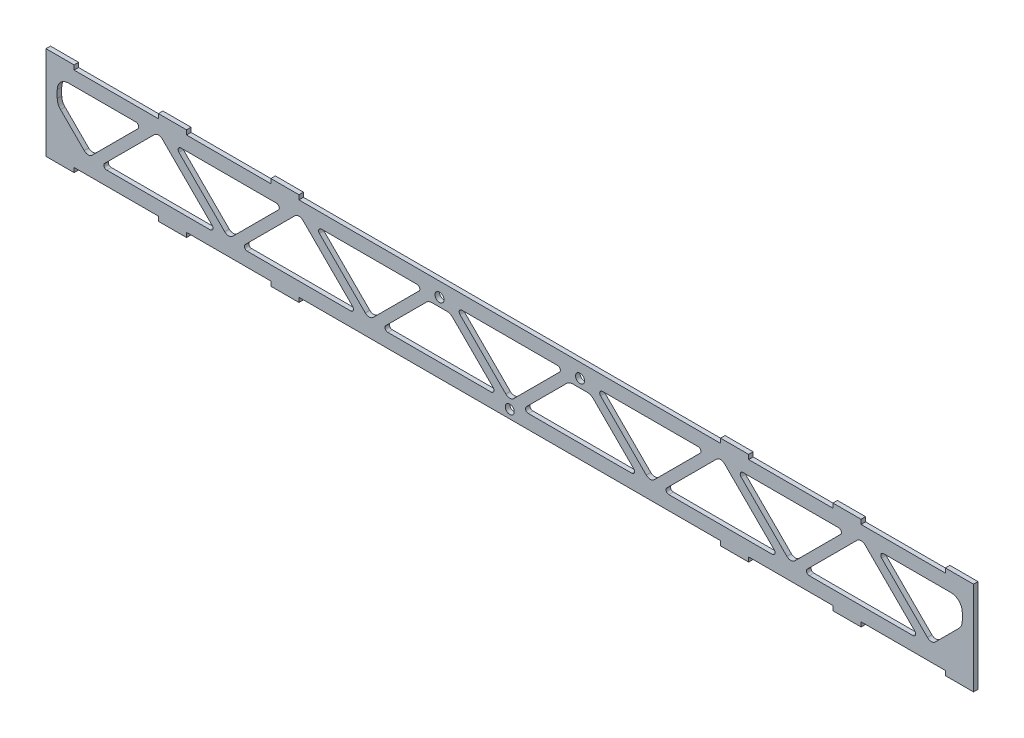
from build123d import *

# Parameters (mm, degrees)
SKETCH1_W           = 360
SKETCH1_H           = 30
BOSS_EXTRUDE1_DEPTH = 1.6
SKETCH2_W           = 10
SKETCH2_H           = 1.6
BOSS_EXTRUDE2_DEPTH = 1.6
CUT_EXTRUDE1_DEPTH  = 181.770904739
CUT_EXTRUDE2_DEPTH  = 181.770904739
SKETCH5_W           = 15
SKETCH5_H           = 30
CUT_EXTRUDE3_DEPTH  = 181.770904739
SKETCH6_W           = 4
SKETCH6_H           = 33.2
BOSS_EXTRUDE3_DEPTH = 1.6
FILLET1_R           = 4
BOSS_EXTRUDE4_DEPTH = 1.6
SKETCH8_R           = 1.6
CUT_EXTRUDE4_DEPTH  = 166.840646405


with BuildPart() as part:
    # Sketch1 → Boss-Extrude1 (new body)
    with BuildSketch(Plane.XY):
        Rectangle(SKETCH1_W, SKETCH1_H)
    extrude(amount=BOSS_EXTRUDE1_DEPTH)

    # Sketch2 → Boss-Extrude2 (add)
    with BuildSketch(Plane.XY.offset(1.6)):
        with Locations((120, 15.8)):
            Rectangle(SKETCH2_W, SKETCH2_H)
        with Locations((80, 15.8)):
            Rectangle(SKETCH2_W, SKETCH2_H)
        with Locations((160, 15.8)):
            Rectangle(SKETCH2_W, SKETCH2_H)
        with Locations((-160, 15.8)):
            Rectangle(SKETCH2_W, SKETCH2_H)
        with Locations((-120, 15.8)):
            Rectangle(SKETCH2_W, SKETCH2_H)
        with Locations((-80, 15.8)):
            Rectangle(SKETCH2_W, SKETCH2_H)
        with Locations((-120, -15.8)):
            Rectangle(SKETCH2_W, SKETCH2_H)
        with Locations((-80, -15.8)):
            Rectangle(SKETCH2_W, SKETCH2_H)
        with Locations((-160, -15.8)):
            Rectangle(SKETCH2_W, SKETCH2_H)
        with Locations((160, -15.8)):
            Rectangle(SKETCH2_W, SKETCH2_H)
        with Locations((120, -15.8)):
            Rectangle(SKETCH2_W, SKETCH2_H)
        with Locations((80, -15.8)):
            Rectangle(SKETCH2_W, SKETCH2_H)
    extrude(amount=-BOSS_EXTRUDE2_DEPTH)

    # Sketch3 → Cut-Extrude1 (cut, through all)
    with BuildSketch(Plane.XY.offset(1.6)):
        with BuildLine():
            Line((-167, 10), (-133, 10))
            ThreePointArc((-133, 10), (-132.076120467, 9.382683432), (-132.292893219, 8.292893219))
            Line((-132.292893219, 8.292893219), (-148.585786438, -8))
            ThreePointArc((-148.585786438, -8), (-150, -8.585786438), (-151.414213562, -8))
            Line((-151.414213562, -8), (-167.707106781, 8.292893219))
            ThreePointArc((-167.707106781, 8.292893219), (-167.923879533, 9.382683432), (-167, 10))
        make_face()
        with BuildLine():
            Line((-117, 10), (-83, 10))
            ThreePointArc((-83, 10), (-82.076120467, 9.382683432), (-82.292893219, 8.292893219))
            Line((-82.292893219, 8.292893219), (-98.585786438, -8))
            ThreePointArc((-98.585786438, -8), (-100, -8.585786438), (-101.414213562, -8))
            Line((-101.414213562, -8), (-117.707106781, 8.292893219))
            ThreePointArc((-117.707106781, 8.292893219), (-117.923879533, 9.382683432), (-117, 10))
        make_face()
        with BuildLine():
            Line((-67, 10), (-33, 10))
            ThreePointArc((-33, 10), (-32.076120467, 9.382683432), (-32.292893219, 8.292893219))
            Line((-32.292893219, 8.292893219), (-48.585786438, -8))
            ThreePointArc((-48.585786438, -8), (-50, -8.585786438), (-51.414213562, -8))
            Line((-51.414213562, -8), (-67.707106781, 8.292893219))
            ThreePointArc((-67.707106781, 8.292893219), (-67.923879533, 9.382683432), (-67, 10))
        make_face()
        with BuildLine():
            Line((-17, 10), (17, 10))
            ThreePointArc((17, 10), (17.923879533, 9.382683432), (17.707106781, 8.292893219))
            Line((17.707106781, 8.292893219), (1.414213562, -8))
            ThreePointArc((1.414213562, -8), (0, -8.585786438), (-1.414213562, -8))
            Line((-1.414213562, -8), (-17.707106781, 8.292893219))
            ThreePointArc((-17.707106781, 8.292893219), (-17.923879533, 9.382683432), (-17, 10))
        make_face()
        with BuildLine():
            Line((33, 10), (67, 10))
            ThreePointArc((67, 10), (67.923879533, 9.382683432), (67.707106781, 8.292893219))
            Line((67.707106781, 8.292893219), (51.414213562, -8))
            ThreePointArc((51.414213562, -8), (50, -8.585786438), (48.585786438, -8))
            Line((48.585786438, -8), (32.292893219, 8.292893219))
            ThreePointArc((32.292893219, 8.292893219), (32.076120467, 9.382683432), (33, 10))
        make_face()
        with BuildLine():
            Line((83, 10), (117, 10))
            ThreePointArc((117, 10), (117.923879533, 9.382683432), (117.707106781, 8.292893219))
            Line((117.707106781, 8.292893219), (101.414213562, -8))
            ThreePointArc((101.414213562, -8), (100, -8.585786438), (98.585786438, -8))
            Line((98.585786438, -8), (82.292893219, 8.292893219))
            ThreePointArc((82.292893219, 8.292893219), (82.076120467, 9.382683432), (83, 10))
        make_face()
        with BuildLine():
            Line((133, 10), (167, 10))
            ThreePointArc((167, 10), (167.923879533, 9.382683432), (167.707106781, 8.292893219))
            Line((167.707106781, 8.292893219), (151.414213562, -8))
            ThreePointArc((151.414213562, -8), (150, -8.585786438), (148.585786438, -8))
            Line((148.585786438, -8), (132.292893219, 8.292893219))
            ThreePointArc((132.292893219, 8.292893219), (132.076120467, 9.382683432), (133, 10))
        make_face()
    extrude(amount=-CUT_EXTRUDE1_DEPTH, mode=Mode.SUBTRACT)

    # Sketch4 → Cut-Extrude2 (cut, through all)
    with BuildSketch(Plane.XY.offset(1.6)):
        with BuildLine():
            Line((-143.414213562, -10), (-106.585786438, -10))
            ThreePointArc((-106.585786438, -10), (-105.661906905, -9.382683432), (-105.878679656, -8.292893219))
            Line((-105.878679656, -8.292893219), (-123.585786438, 9.414213562))
            ThreePointArc((-123.585786438, 9.414213562), (-125, 10), (-126.414213562, 9.414213562))
            Line((-126.414213562, 9.414213562), (-144.121320344, -8.292893219))
            ThreePointArc((-144.121320344, -8.292893219), (-144.338093095, -9.382683432), (-143.414213562, -10))
        make_face()
        with BuildLine():
            Line((-93.414213562, -10), (-56.585786438, -10))
            ThreePointArc((-56.585786438, -10), (-55.661906905, -9.382683432), (-55.878679656, -8.292893219))
            Line((-55.878679656, -8.292893219), (-73.585786438, 9.414213562))
            ThreePointArc((-73.585786438, 9.414213562), (-75, 10), (-76.414213562, 9.414213562))
            Line((-76.414213562, 9.414213562), (-94.121320344, -8.292893219))
            ThreePointArc((-94.121320344, -8.292893219), (-94.338093095, -9.382683432), (-93.414213562, -10))
        make_face()
        with BuildLine():
            Line((-43.414213562, -10), (-6.585786438, -10))
            ThreePointArc((-6.585786438, -10), (-5.661906905, -9.382683432), (-5.878679656, -8.292893219))
            Line((-5.878679656, -8.292893219), (-23.585786438, 9.414213562))
            ThreePointArc((-23.585786438, 9.414213562), (-25, 10), (-26.414213562, 9.414213562))
            Line((-26.414213562, 9.414213562), (-44.121320344, -8.292893219))
            ThreePointArc((-44.121320344, -8.292893219), (-44.338093095, -9.382683432), (-43.414213562, -10))
        make_face()
        with BuildLine():
            Line((6.585786438, -10), (43.414213562, -10))
            ThreePointArc((43.414213562, -10), (44.338093095, -9.382683432), (44.121320344, -8.292893219))
            Line((44.121320344, -8.292893219), (26.414213562, 9.414213562))
            ThreePointArc((26.414213562, 9.414213562), (25, 10), (23.585786438, 9.414213562))
            Line((23.585786438, 9.414213562), (5.878679656, -8.292893219))
            ThreePointArc((5.878679656, -8.292893219), (5.661906905, -9.382683432), (6.585786438, -10))
        make_face()
        with BuildLine():
            Line((56.585786438, -10), (93.414213562, -10))
            ThreePointArc((93.414213562, -10), (94.338093095, -9.382683432), (94.121320344, -8.292893219))
            Line((94.121320344, -8.292893219), (76.414213562, 9.414213562))
            ThreePointArc((76.414213562, 9.414213562), (75, 10), (73.585786438, 9.414213562))
            Line((73.585786438, 9.414213562), (55.878679656, -8.292893219))
            ThreePointArc((55.878679656, -8.292893219), (55.661906905, -9.382683432), (56.585786438, -10))
        make_face()
        with BuildLine():
            Line((106.585786438, -10), (143.414213562, -10))
            ThreePointArc((143.414213562, -10), (144.338093095, -9.382683432), (144.121320344, -8.292893219))
            Line((144.121320344, -8.292893219), (126.414213562, 9.414213562))
            ThreePointArc((126.414213562, 9.414213562), (125, 10), (123.585786438, 9.414213562))
            Line((123.585786438, 9.414213562), (105.878679656, -8.292893219))
            ThreePointArc((105.878679656, -8.292893219), (105.661906905, -9.382683432), (106.585786438, -10))
        make_face()
    extrude(amount=-CUT_EXTRUDE2_DEPTH, mode=Mode.SUBTRACT)

    # Sketch5 → Cut-Extrude3 (cut, through all)
    with BuildSketch(Plane.XY.offset(1.6)):
        with Locations((-172.5, 0)):
            Rectangle(SKETCH5_W, SKETCH5_H)
        with Locations((172.5, 0)):
            Rectangle(SKETCH5_W, SKETCH5_H)
    extrude(amount=-CUT_EXTRUDE3_DEPTH, mode=Mode.SUBTRACT)

    # Sketch6 → Boss-Extrude3 (add)
    with BuildSketch(Plane.XY.offset(1.6)):
        with Locations((-163, 0)):
            Rectangle(SKETCH6_W, SKETCH6_H)
        with Locations((163, 0)):
            Rectangle(SKETCH6_W, SKETCH6_H)
    extrude(amount=-BOSS_EXTRUDE3_DEPTH)

    # Fillet1
    fillet1_edges = [part.edges().sort_by_distance(p)[0] for p in [
        (-161, 10, 0.8),
        (-161, 1.585786438, 0.8),
        (161, 1.585786438, 0.8),
        (161, 10, 0.8),
    ]]
    fillet(fillet1_edges, radius=FILLET1_R)

    # Sketch7 → Boss-Extrude4 (add)
    with BuildSketch(Plane.XY.offset(1.6)):
        with BuildLine():
            Line((-26.414213562, 9.414213562), (-29.707106781, 6.121320344))
            ThreePointArc((-29.707106781, 6.121320344), (-28.733836735, 6.771638598), (-27.585786438, 7))
            Line((-27.585786438, 7), (-22.414213562, 7))
            ThreePointArc((-22.414213562, 7), (-21.266163265, 6.771638598), (-20.292893219, 6.121320344))
            Line((-20.292893219, 6.121320344), (-23.585786438, 9.414213562))
            ThreePointArc((-23.585786438, 9.414213562), (-25, 10), (-26.414213562, 9.414213562))
        make_face()
        with BuildLine():
            Line((23.585786438, 9.414213562), (20.292893219, 6.121320344))
            ThreePointArc((20.292893219, 6.121320344), (21.266163265, 6.771638598), (22.414213562, 7))
            Line((22.414213562, 7), (27.585786438, 7))
            ThreePointArc((27.585786438, 7), (28.733836735, 6.771638598), (29.707106781, 6.121320344))
            Line((29.707106781, 6.121320344), (26.414213562, 9.414213562))
            ThreePointArc((26.414213562, 9.414213562), (25, 10), (23.585786438, 9.414213562))
        make_face()
    extrude(amount=-BOSS_EXTRUDE4_DEPTH)

    # Sketch8 → Cut-Extrude4 (cut, through all)
    with BuildSketch(Plane.XY.offset(1.6)):
        with Locations((-25, 10)):
            Circle(SKETCH8_R)
        with Locations(Location((25, 10, 0), (0, 0, 180))):
            Circle(SKETCH8_R)
        with Locations((0, -12)):
            Circle(SKETCH8_R)
    extrude(amount=-CUT_EXTRUDE4_DEPTH, mode=Mode.SUBTRACT)


solid = part.part
